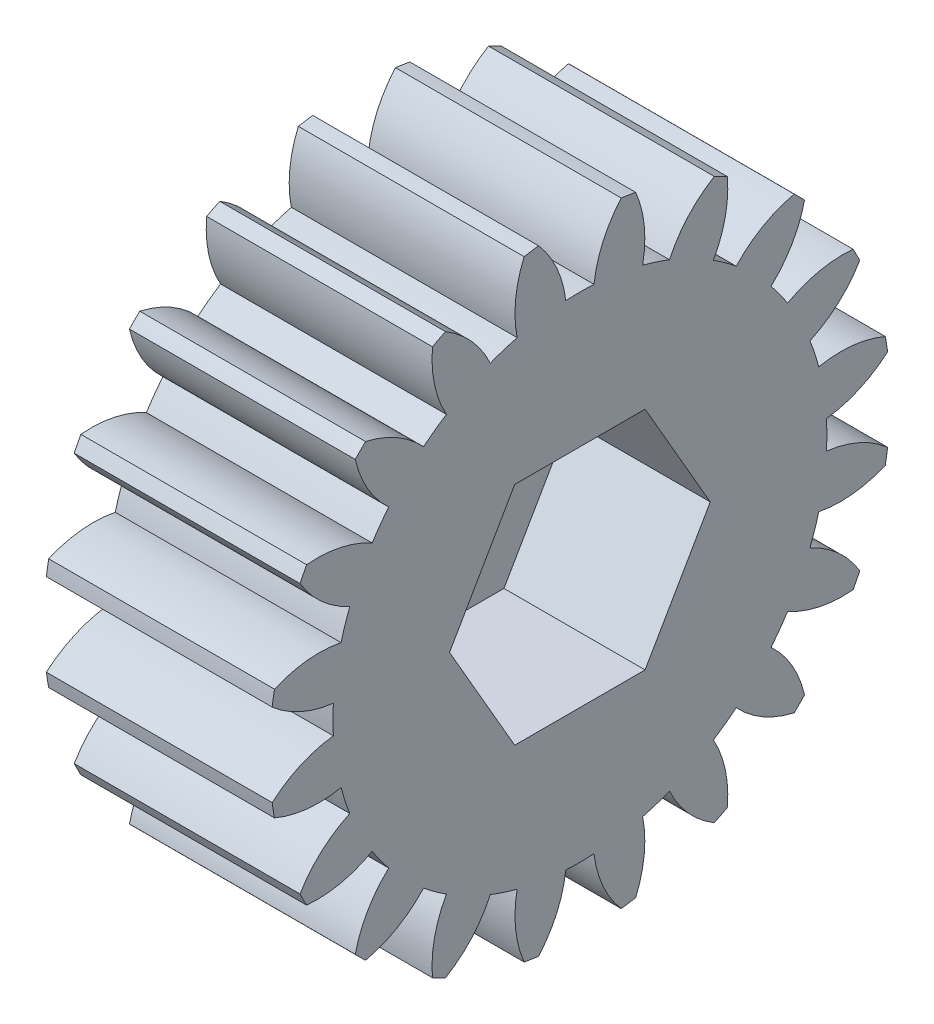
from build123d import *

# Parameters (mm, degrees)
SKETCH_1_W                = 8
SKETCH_1_H                = 11
CUT_EXTRUDE_1_DEPTH       = 18.492855685
CUT_EXTRUDE_2_DEPTH       = 18.492855685
CUT_EXTRUDE_3_DEPTH       = 18.492855685
CUT_EXTRUDE_4_DEPTH       = 18.492855685
CUT_EXTRUDE_5_DEPTH       = 18.492855685
CUT_EXTRUDE_6_DEPTH       = 18.492855685
CUT_EXTRUDE_7_DEPTH       = 18.492855685
CUT_EXTRUDE_8_DEPTH       = 18.492855685
CUT_EXTRUDE_9_DEPTH       = 18.492855685
CUT_EXTRUDE_10_DEPTH      = 18.492855685
CUT_EXTRUDE_11_DEPTH      = 18.492855685
CUT_EXTRUDE_12_DEPTH      = 18.431405642
CUT_EXTRUDE_13_DEPTH      = 18.431405642
CUT_EXTRUDE_14_DEPTH      = 18.431405642
CUT_EXTRUDE_15_DEPTH      = 18.431405642
CUT_EXTRUDE_16_DEPTH      = 18.431405642
CUT_EXTRUDE_17_DEPTH      = 18.369738204
CUT_EXTRUDE_18_DEPTH      = 18.369738204
CUT_EXTRUDE_19_DEPTH      = 18.369738204
CUT_EXTRUDE_20_DEPTH      = 18.369738204
CUT_EXTRUDE_21_DEPTH      = 5
HOLE_WIZARD_5_0_5_1_D     = 5
HOLE_WIZARD_5_0_5_1_DEPTH = 8


with BuildPart() as part:
    # 草圖1 → 旋轉1 (revolve)
    with BuildSketch(Plane(origin=(0, 0, 0), x_dir=(-1, 0, 0), z_dir=(0, 0, -1)), mode=Mode.PRIVATE) as revolve_1_sk:
        with Locations((-4, 5.5)):
            Rectangle(SKETCH_1_W, SKETCH_1_H)
    revolve(revolve_1_sk.sketch.rotate(Axis((8, 0, 0), (-1, 0, 0)), 270), axis=Axis((8, 0, 0), (-1, 0, 0)))

    # 草圖2 → 除料-伸長1 (cut, through all)
    with BuildSketch(Plane.ZY):
        with BuildLine():
            ThreePointArc((10.902013697, -1.464956435), (11, 0), (10.902013697, 1.464956435))
            ThreePointArc((10.902013697, 1.464956435), (9.891552344, 0.818060825), (8.734705318, 0.499924007))
            ThreePointArc((8.734705318, 0.499924007), (8.749, 0), (8.734705318, -0.499924007))
            ThreePointArc((8.734705318, -0.499924007), (9.891552344, -0.818060825), (10.902013697, -1.464956435))
        make_face()
    extrude(amount=-CUT_EXTRUDE_1_DEPTH, mode=Mode.SUBTRACT)

    # 草圖3 → 除料-伸長2 (cut, through all)
    with BuildSketch(Plane.ZY):
        with BuildLine():
            ThreePointArc((9.915734733, -4.762163869), (10.461621679, -3.399186938), (10.821127601, -1.975651141))
            ThreePointArc((10.821127601, -1.975651141), (9.66022001, -2.278635697), (8.461683425, -2.223716399))
            ThreePointArc((8.461683425, -2.223716399), (8.320793461, -2.703589684), (8.152713396, -3.174628369))
            ThreePointArc((8.152713396, -3.174628369), (9.154630615, -3.834679853), (9.915734733, -4.762163869))
        make_face()
    extrude(amount=-CUT_EXTRUDE_2_DEPTH, mode=Mode.SUBTRACT)

    # 草圖4 → 除料-伸長3 (cut, through all)
    with BuildSketch(Plane.ZY):
        with BuildLine():
            ThreePointArc((7.958834566, -7.593217523), (8.899186938, -6.465637775), (9.680994141, -5.222868219))
            ThreePointArc((9.680994141, -5.222868219), (8.483278035, -5.15228348), (7.360373002, -4.729683951))
            ThreePointArc((7.360373002, -4.729683951), (7.078089684, -5.142533172), (6.772677084, -5.538577987))
            ThreePointArc((6.772677084, -5.538577987), (7.521589858, -6.4759337), (7.958834566, -7.593217523))
        make_face()
    extrude(amount=-CUT_EXTRUDE_3_DEPTH, mode=Mode.SUBTRACT)

    # 草圖5 → 除料-伸長4 (cut, through all)
    with BuildSketch(Plane.ZY):
        with BuildLine():
            ThreePointArc((5.222868219, -9.680994141), (6.465637775, -8.899186938), (7.593217523, -7.958834566))
            ThreePointArc((7.593217523, -7.958834566), (6.4759337, -7.521589858), (5.538577987, -6.772677084))
            ThreePointArc((5.538577987, -6.772677084), (5.142533172, -7.078089684), (4.729683951, -7.360373002))
            ThreePointArc((4.729683951, -7.360373002), (5.15228348, -8.483278035), (5.222868219, -9.680994141))
        make_face()
    extrude(amount=-CUT_EXTRUDE_4_DEPTH, mode=Mode.SUBTRACT)

    # 草圖6 → 除料-伸長5 (cut, through all)
    with BuildSketch(Plane.ZY):
        with BuildLine():
            ThreePointArc((1.975651141, -10.821127601), (3.399186938, -10.461621679), (4.762163869, -9.915734733))
            ThreePointArc((4.762163869, -9.915734733), (3.834679853, -9.154630615), (3.174628369, -8.152713396))
            ThreePointArc((3.174628369, -8.152713396), (2.703589684, -8.320793461), (2.223716399, -8.461683425))
            ThreePointArc((2.223716399, -8.461683425), (2.278635697, -9.66022001), (1.975651141, -10.821127601))
        make_face()
    extrude(amount=-CUT_EXTRUDE_5_DEPTH, mode=Mode.SUBTRACT)

    # 草圖7 → 除料-伸長6 (cut, through all)
    with BuildSketch(Plane.ZY):
        with BuildLine():
            ThreePointArc((-1.464956435, -10.902013697), (0, -11), (1.464956435, -10.902013697))
            ThreePointArc((1.464956435, -10.902013697), (0.818060825, -9.891552344), (0.499924007, -8.734705318))
            ThreePointArc((0.499924007, -8.734705318), (0, -8.749), (-0.499924007, -8.734705318))
            ThreePointArc((-0.499924007, -8.734705318), (-0.818060825, -9.891552344), (-1.464956435, -10.902013697))
        make_face()
    extrude(amount=-CUT_EXTRUDE_6_DEPTH, mode=Mode.SUBTRACT)

    # 草圖8 → 除料-伸長7 (cut, through all)
    with BuildSketch(Plane.ZY):
        with BuildLine():
            ThreePointArc((-4.762163869, -9.915734733), (-3.399186938, -10.461621679), (-1.975651141, -10.821127601))
            ThreePointArc((-1.975651141, -10.821127601), (-2.278635697, -9.66022001), (-2.223716399, -8.461683425))
            ThreePointArc((-2.223716399, -8.461683425), (-2.703589684, -8.320793461), (-3.174628369, -8.152713396))
            ThreePointArc((-3.174628369, -8.152713396), (-3.834679853, -9.154630615), (-4.762163869, -9.915734733))
        make_face()
    extrude(amount=-CUT_EXTRUDE_7_DEPTH, mode=Mode.SUBTRACT)

    # 草圖9 → 除料-伸長8 (cut, through all)
    with BuildSketch(Plane.ZY):
        with BuildLine():
            ThreePointArc((-7.593217523, -7.958834566), (-6.465637775, -8.899186938), (-5.222868219, -9.680994141))
            ThreePointArc((-5.222868219, -9.680994141), (-5.15228348, -8.483278035), (-4.729683951, -7.360373002))
            ThreePointArc((-4.729683951, -7.360373002), (-5.142533172, -7.078089684), (-5.538577987, -6.772677084))
            ThreePointArc((-5.538577987, -6.772677084), (-6.4759337, -7.521589858), (-7.593217523, -7.958834566))
        make_face()
    extrude(amount=-CUT_EXTRUDE_8_DEPTH, mode=Mode.SUBTRACT)

    # 草圖10 → 除料-伸長9 (cut, through all)
    with BuildSketch(Plane.ZY):
        with BuildLine():
            ThreePointArc((-9.680994141, -5.222868219), (-8.899186938, -6.465637775), (-7.958834566, -7.593217523))
            ThreePointArc((-7.958834566, -7.593217523), (-7.521589858, -6.4759337), (-6.772677084, -5.538577987))
            ThreePointArc((-6.772677084, -5.538577987), (-7.078089684, -5.142533172), (-7.360373002, -4.729683951))
            ThreePointArc((-7.360373002, -4.729683951), (-8.483278035, -5.15228348), (-9.680994141, -5.222868219))
        make_face()
    extrude(amount=-CUT_EXTRUDE_9_DEPTH, mode=Mode.SUBTRACT)

    # 草圖11 → 除料-伸長10 (cut, through all)
    with BuildSketch(Plane.ZY):
        with BuildLine():
            ThreePointArc((-10.821127601, -1.975651141), (-10.461621679, -3.399186938), (-9.915734733, -4.762163869))
            ThreePointArc((-9.915734733, -4.762163869), (-9.154630615, -3.834679853), (-8.152713396, -3.174628369))
            ThreePointArc((-8.152713396, -3.174628369), (-8.320793461, -2.703589684), (-8.461683425, -2.223716399))
            ThreePointArc((-8.461683425, -2.223716399), (-9.66022001, -2.278635697), (-10.821127601, -1.975651141))
        make_face()
    extrude(amount=-CUT_EXTRUDE_10_DEPTH, mode=Mode.SUBTRACT)

    # 草圖12 → 除料-伸長11 (cut, through all)
    with BuildSketch(Plane.ZY):
        with BuildLine():
            ThreePointArc((-10.902013697, 1.464956435), (-11, 0), (-10.902013697, -1.464956435))
            ThreePointArc((-10.902013697, -1.464956435), (-9.891552344, -0.818060825), (-8.734705318, -0.499924007))
            ThreePointArc((-8.734705318, -0.499924007), (-8.749, 0), (-8.734705318, 0.499924007))
            ThreePointArc((-8.734705318, 0.499924007), (-9.891552344, 0.818060825), (-10.902013697, 1.464956435))
        make_face()
    extrude(amount=-CUT_EXTRUDE_11_DEPTH, mode=Mode.SUBTRACT)

    # 草圖13 → 除料-伸長12 (cut, through all)
    with BuildSketch(Plane.ZY):
        with BuildLine():
            ThreePointArc((-9.915734733, 4.762163869), (-10.461621679, 3.399186938), (-10.821127601, 1.975651141))
            ThreePointArc((-10.821127601, 1.975651141), (-9.66022001, 2.278635697), (-8.461683425, 2.223716399))
            ThreePointArc((-8.461683425, 2.223716399), (-8.320793461, 2.703589684), (-8.152713396, 3.174628369))
            ThreePointArc((-8.152713396, 3.174628369), (-9.154630615, 3.834679853), (-9.915734733, 4.762163869))
        make_face()
    extrude(amount=-CUT_EXTRUDE_12_DEPTH, mode=Mode.SUBTRACT)

    # 草圖14 → 除料-伸長13 (cut, through all)
    with BuildSketch(Plane.ZY):
        with BuildLine():
            ThreePointArc((-7.958834566, 7.593217523), (-8.899186938, 6.465637775), (-9.680994141, 5.222868219))
            ThreePointArc((-9.680994141, 5.222868219), (-8.483278035, 5.15228348), (-7.360373002, 4.729683951))
            ThreePointArc((-7.360373002, 4.729683951), (-7.078089684, 5.142533172), (-6.772677084, 5.538577987))
            ThreePointArc((-6.772677084, 5.538577987), (-7.521589858, 6.4759337), (-7.958834566, 7.593217523))
        make_face()
    extrude(amount=-CUT_EXTRUDE_13_DEPTH, mode=Mode.SUBTRACT)

    # 草圖15 → 除料-伸長14 (cut, through all)
    with BuildSketch(Plane.ZY):
        with BuildLine():
            ThreePointArc((-5.222868219, 9.680994141), (-6.465637775, 8.899186938), (-7.593217523, 7.958834566))
            ThreePointArc((-7.593217523, 7.958834566), (-6.4759337, 7.521589858), (-5.538577987, 6.772677084))
            ThreePointArc((-5.538577987, 6.772677084), (-5.142533172, 7.078089684), (-4.729683951, 7.360373002))
            ThreePointArc((-4.729683951, 7.360373002), (-5.15228348, 8.483278035), (-5.222868219, 9.680994141))
        make_face()
    extrude(amount=-CUT_EXTRUDE_14_DEPTH, mode=Mode.SUBTRACT)

    # 草圖16 → 除料-伸長15 (cut, through all)
    with BuildSketch(Plane.ZY):
        with BuildLine():
            ThreePointArc((-1.975651141, 10.821127601), (-3.399186938, 10.461621679), (-4.762163869, 9.915734733))
            ThreePointArc((-4.762163869, 9.915734733), (-3.834679853, 9.154630615), (-3.174628369, 8.152713396))
            ThreePointArc((-3.174628369, 8.152713396), (-2.703589684, 8.320793461), (-2.223716399, 8.461683425))
            ThreePointArc((-2.223716399, 8.461683425), (-2.278635697, 9.66022001), (-1.975651141, 10.821127601))
        make_face()
    extrude(amount=-CUT_EXTRUDE_15_DEPTH, mode=Mode.SUBTRACT)

    # 草圖17 → 除料-伸長16 (cut, through all)
    with BuildSketch(Plane.ZY):
        with BuildLine():
            ThreePointArc((1.464956435, 10.902013697), (0, 11), (-1.464956435, 10.902013697))
            ThreePointArc((-1.464956435, 10.902013697), (-0.818060825, 9.891552344), (-0.499924007, 8.734705318))
            ThreePointArc((-0.499924007, 8.734705318), (0, 8.749), (0.499924007, 8.734705318))
            ThreePointArc((0.499924007, 8.734705318), (0.818060825, 9.891552344), (1.464956435, 10.902013697))
        make_face()
    extrude(amount=-CUT_EXTRUDE_16_DEPTH, mode=Mode.SUBTRACT)

    # 草圖18 → 除料-伸長17 (cut, through all)
    with BuildSketch(Plane.ZY):
        with BuildLine():
            ThreePointArc((4.762163869, 9.915734733), (3.399186938, 10.461621679), (1.975651141, 10.821127601))
            ThreePointArc((1.975651141, 10.821127601), (2.278635697, 9.66022001), (2.223716399, 8.461683425))
            ThreePointArc((2.223716399, 8.461683425), (2.703589684, 8.320793461), (3.174628369, 8.152713396))
            ThreePointArc((3.174628369, 8.152713396), (3.834679853, 9.154630615), (4.762163869, 9.915734733))
        make_face()
    extrude(amount=-CUT_EXTRUDE_17_DEPTH, mode=Mode.SUBTRACT)

    # 草圖19 → 除料-伸長18 (cut, through all)
    with BuildSketch(Plane.ZY):
        with BuildLine():
            ThreePointArc((7.593217523, 7.958834566), (6.465637775, 8.899186938), (5.222868219, 9.680994141))
            ThreePointArc((5.222868219, 9.680994141), (5.15228348, 8.483278035), (4.729683951, 7.360373002))
            ThreePointArc((4.729683951, 7.360373002), (5.142533172, 7.078089684), (5.538577987, 6.772677084))
            ThreePointArc((5.538577987, 6.772677084), (6.4759337, 7.521589858), (7.593217523, 7.958834566))
        make_face()
    extrude(amount=-CUT_EXTRUDE_18_DEPTH, mode=Mode.SUBTRACT)

    # 草圖20 → 除料-伸長19 (cut, through all)
    with BuildSketch(Plane.ZY):
        with BuildLine():
            ThreePointArc((9.680994141, 5.222868219), (8.899186938, 6.465637775), (7.958834566, 7.593217523))
            ThreePointArc((7.958834566, 7.593217523), (7.521589858, 6.4759337), (6.772677084, 5.538577987))
            ThreePointArc((6.772677084, 5.538577987), (7.078089684, 5.142533172), (7.360373002, 4.729683951))
            ThreePointArc((7.360373002, 4.729683951), (8.483278035, 5.15228348), (9.680994141, 5.222868219))
        make_face()
    extrude(amount=-CUT_EXTRUDE_19_DEPTH, mode=Mode.SUBTRACT)

    # 草圖21 → 除料-伸長20 (cut, through all)
    with BuildSketch(Plane.ZY):
        with BuildLine():
            ThreePointArc((10.821127601, 1.975651141), (10.461621679, 3.399186938), (9.915734733, 4.762163869))
            ThreePointArc((9.915734733, 4.762163869), (9.154630615, 3.834679853), (8.152713396, 3.174628369))
            ThreePointArc((8.152713396, 3.174628369), (8.320793461, 2.703589684), (8.461683425, 2.223716399))
            ThreePointArc((8.461683425, 2.223716399), (9.66022001, 2.278635697), (10.821127601, 1.975651141))
        make_face()
    extrude(amount=-CUT_EXTRUDE_20_DEPTH, mode=Mode.SUBTRACT)

    # 草圖22 → 除料-伸長21 (cut)
    with BuildSketch(Plane(origin=(8, 0, 0), x_dir=(0, 0, -1), z_dir=(1, 0, 0))):
        Polygon((-4.618802154, 0), (-2.309401077, -4), (2.309401077, -4), (4.618802154, 0), (2.309401077, 4), (-2.309401077, 4), align=None)
    extrude(amount=-CUT_EXTRUDE_21_DEPTH, mode=Mode.SUBTRACT)

    # Ø5.0 (5) 直徑孔1
    with Locations(Plane.ZY):
        with Locations((0, 0)):
            Hole(HOLE_WIZARD_5_0_5_1_D / 2, depth=HOLE_WIZARD_5_0_5_1_DEPTH)


solid = part.part
